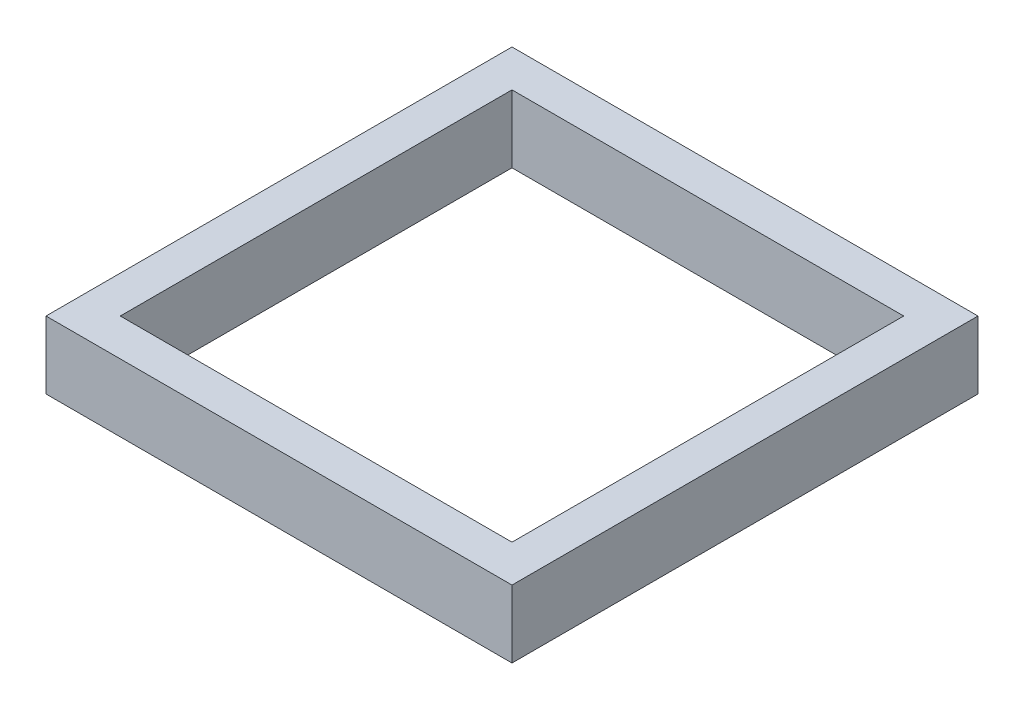
from build123d import *

# Parameters (mm, degrees)
SKETCH1_W           = 876.3
SKETCH1_H           = 876.3
SKETCH1_W_2         = 736.6
SKETCH1_H_2         = 736.6
BOSS_EXTRUDE1_DEPTH = 127


with BuildPart() as part:
    # Sketch1 → Boss-Extrude1 (new body)
    with BuildSketch(Plane(origin=(0, 0, 0), x_dir=(1, 0, 0), z_dir=(0, 1, 0))):
        Rectangle(SKETCH1_W, SKETCH1_H)
        Rectangle(SKETCH1_W_2, SKETCH1_H_2, mode=Mode.SUBTRACT)
    extrude(amount=BOSS_EXTRUDE1_DEPTH)


solid = part.part
